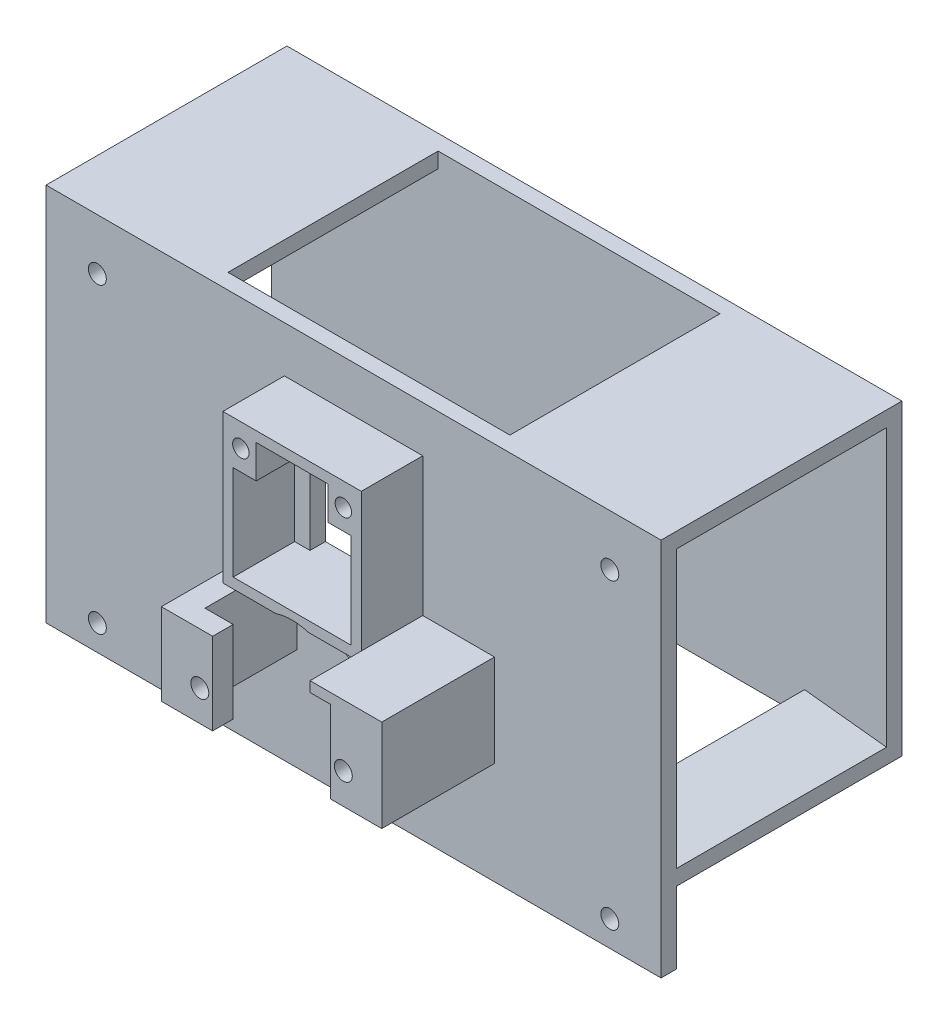
from build123d import *
from build123d.topology import SkipClean

# Parameters (mm, degrees)
SKETCH_1_W           = 120
SKETCH_1_H           = 60
EXTRUDE_1_DEPTH      = 47
SHELL_2_T            = -3
SKETCH_2_W           = 55
SKETCH_2_H           = 41
CUT_EXTRUDE_1_DEPTH  = 3
SKETCH_5_W           = 88
SKETCH_5_H           = 41
CUT_EXTRUDE_3_DEPTH  = 10
SKETCH_6_R           = 2.5
CUT_EXTRUDE_4_DEPTH  = 82.908485519
EXTRUDE_4_REACH      = 82.225
CUT_EXTRUDE_5_REACH  = 83.908
SKETCH_9_W           = 17
SKETCH_9_H           = 25
SKETCH_10_W          = 27
SKETCH_10_H          = 29
SKETCH_10_R          = 1.6
EXTRUDE_5_DEPTH      = 12
SKETCH_14_W          = 10
SKETCH_14_H          = 16
SKETCH_14_R          = 1.75
EXTRUDE_7_DEPTH      = 22
SKETCH_15_R          = 10.5
CUT_EXTRUDE_7_DEPTH  = 12
CUT_EXTRUDE_8_DEPTH  = 6
CUT_EXTRUDE_9_REACH  = 83.908
SKETCH_19_W          = 34
SKETCH_19_H          = 16
SKETCH_16_W          = 14
SKETCH_16_H          = 2
EXTRUDE_8_DEPTH      = 22
SKETCH_20_W          = 6
SKETCH_20_H          = 6
CUT_EXTRUDE_10_DEPTH = 5
SKETCH_21_W          = 120
SKETCH_21_H          = 3
EXTRUDE_9_DEPTH      = 14
SKETCH_11_R          = 1.75
CUT_EXTRUDE_6_DEPTH  = 89.005681635


with BuildPart() as part:
    # 草图1 → 凸台-拉伸1 (new body)
    with BuildSketch(Plane(origin=(0, 0, 0), x_dir=(1, 0, 0), z_dir=(0, 0, -1))):
        Rectangle(SKETCH_1_W, SKETCH_1_H)
    extrude(amount=EXTRUDE_1_DEPTH)

    # 抽壳2
    shell_2_openings = [part.faces().sort_by_distance(p)[0] for p in [
        (60, 0, -23.5),
        (-60, 0, -23.5),
    ]]
    offset(amount=SHELL_2_T, openings=shell_2_openings, kind=Kind.INTERSECTION)

    # 草图2 → 切除-拉伸1 (cut)
    with BuildSketch(Plane(origin=(0, 30, 45), x_dir=(-1, 0, 0), z_dir=(0, -1, 0))):
        with Locations((0, 68.5)):
            Rectangle(SKETCH_2_W, SKETCH_2_H)
    extrude(amount=CUT_EXTRUDE_1_DEPTH, mode=Mode.SUBTRACT)

    # 草图5 → 切除-拉伸3 (cut)
    with BuildSketch(Plane.XZ.offset(30)):
        with Locations((0, -23.5)):
            Rectangle(SKETCH_5_W, SKETCH_5_H)
    extrude(amount=-CUT_EXTRUDE_3_DEPTH, mode=Mode.SUBTRACT)

    # 草图6 → 切除-拉伸4 (cut, through all)
    with BuildSketch(Plane.XY):
        with Locations((0, -18)):
            Circle(SKETCH_6_R)
    extrude(amount=-CUT_EXTRUDE_4_DEPTH, mode=Mode.SUBTRACT)

    # 草图8 → 凸台-拉伸4 (add, up to next)
    with BuildSketch(Plane(origin=(0, 0, -44), x_dir=(-1, 0, 0), z_dir=(0, 0, -1)), mode=Mode.PRIVATE) as extrude_4_sk1:
        Polygon((-60, -27), (-44, -25.270549885), (-44, -30), (-60, -30), align=None)
    extrude_4_tool1 = extrude(extrude_4_sk1.sketch, amount=-EXTRUDE_4_REACH, mode=Mode.PRIVATE) - part.part
    extrude_4 = extrude_4_tool1.solids().sort_by_distance((51.403338, -28.035391, -44))[0]
    add(extrude_4)

    # 镜向1: 凸台-拉伸4 across plane
    add(extrude_4.mirror(Plane(origin=(0, 0, 0), x_dir=(0, 0, 1), z_dir=(1, 0, 0))))

    # 草图9 → 切除-拉伸5 (cut, up to next)
    with BuildSketch(Plane.XY, mode=Mode.PRIVATE) as cut_extrude_5_sk1:
        with Locations((0, 6.5)):
            Rectangle(SKETCH_9_W, SKETCH_9_H)
    cut_extrude_5_tool1 = extrude(cut_extrude_5_sk1.sketch, amount=-CUT_EXTRUDE_5_REACH, mode=Mode.PRIVATE) & part.part
    add(cut_extrude_5_tool1.solids().sort_by_distance((0, 6.5, 0))[0], mode=Mode.SUBTRACT)

    # 草图10 → 凸台-拉伸5 (add)
    with BuildSketch(Plane.XY):
        with Locations((0, 6.5)):
            Rectangle(SKETCH_10_W, SKETCH_10_H)
        with Locations(Location((-10, 16.5, 0), (0, 0, 339.635865194))):
            Circle(SKETCH_10_R, mode=Mode.SUBTRACT)
        with Locations(Location((10, 16.5, 0), (0, 0, 159.635865194))):
            Circle(SKETCH_10_R, mode=Mode.SUBTRACT)
        Polygon((-11.5, -6), (11.5, -6), (11.5, 12.5), (7, 12.5), (7, 19), (-7, 19), (-7, 12.5), (-11.5, 12.5), align=None, mode=Mode.SUBTRACT)
    extrude(amount=EXTRUDE_5_DEPTH)

    # 草图14 → 凸台-拉伸7 (add)
    # profile 1 of 2: a face of its own
    with BuildSketch(Plane.XY):
        with Locations((-10.5, -16)):
            Rectangle(SKETCH_14_W, SKETCH_14_H)
        with Locations((-8, -18)):
            Circle(SKETCH_14_R, mode=Mode.SUBTRACT)
    # profile 2 of 2: a face of its own
    with BuildSketch(Plane.XY):
        with Locations((22.5, -16)):
            Rectangle(SKETCH_14_W, SKETCH_14_H)
        with Locations((20, -18)):
            Circle(SKETCH_14_R, mode=Mode.SUBTRACT)
    extrude(amount=EXTRUDE_7_DEPTH)

    # 草图15 → 切除-拉伸7 (cut)
    with BuildSketch(Plane.XY):
        with Locations((0, -18)):
            Circle(SKETCH_15_R)
    extrude(amount=CUT_EXTRUDE_7_DEPTH, mode=Mode.SUBTRACT)

    # 草图17 → 切除-拉伸8 (cut)
    with SkipClean():  # the faces are left unmerged after this step: merging them gives an invalid solid
        with BuildSketch(Plane(origin=(0, 0, 12), x_dir=(-1, 0, 0), z_dir=(0, 0, -1))):
            with BuildLine():
                Line((5.5, -9.05572809), (5.5, -24))
                Line((5.5, -24), (8.61684397, -24))
                ThreePointArc((8.61684397, -24), (10.278819808, -15.856203519), (5.5, -9.05572809))
            make_face()
        extrude(amount=-CUT_EXTRUDE_8_DEPTH, mode=Mode.SUBTRACT)

    # 切除-拉伸9: up to this face of the body (flat: up to its plane)
    cut_extrude_9_end = Plane(part.part.faces().sort_by_distance((-5.657585298, -16.527864045, 18))[0])
    # 草图19 → 切除-拉伸9 (cut, up to the picked face)
    with BuildSketch(Plane.XY, mode=Mode.PRIVATE) as cut_extrude_9_sk1:
        with Locations((6, -16)):
            Rectangle(SKETCH_19_W, SKETCH_19_H)
    cut_extrude_9_tool1 = split(extrude(cut_extrude_9_sk1.sketch, amount=CUT_EXTRUDE_9_REACH, mode=Mode.PRIVATE), bisect_by=cut_extrude_9_end, keep=Keep.BOTH, mode=Mode.PRIVATE)
    add(cut_extrude_9_tool1.solids().sort_by(Axis((6, -16, 0), (0, 0, 1)))[0], mode=Mode.SUBTRACT)

    # 草图16 → 凸台-拉伸8 (add)
    with BuildSketch(Plane.XY):
        with Locations((20.5, -7)):
            Rectangle(SKETCH_16_W, SKETCH_16_H)
    extrude(amount=EXTRUDE_8_DEPTH)

    # 草图20 → 切除-拉伸10 (cut)
    with BuildSketch(Plane(origin=(0, 0, -3), x_dir=(-1, 0, 0), z_dir=(0, 0, -1))):
        with Locations((-10, 16.5)):
            Rectangle(SKETCH_20_W, SKETCH_20_H)
        with Locations((10, 16.5)):
            Rectangle(SKETCH_20_W, SKETCH_20_H)
    extrude(amount=-CUT_EXTRUDE_10_DEPTH, mode=Mode.SUBTRACT)

    # 草图21 → 凸台-拉伸9 (add)
    with BuildSketch(Plane.XZ.offset(30)):
        with Locations((0, -1.5)):
            Rectangle(SKETCH_21_W, SKETCH_21_H)
    extrude(amount=EXTRUDE_9_DEPTH)

    # 草图11 → 切除-拉伸6 (cut, through all)
    with BuildSketch(Plane(origin=(0, 0, 0), x_dir=(-1, 0, 0), z_dir=(0, 0, -1))):
        with Locations(Location((-50, 20, 0), (0, 0, 180))):
            Circle(SKETCH_11_R)
        with Locations(Location((50, 20, 0), (0, 0, 180))):
            Circle(SKETCH_11_R)
        with Locations(Location((-50, -39, 0), (0, 0, 180))):
            Circle(SKETCH_11_R)
        with Locations(Location((50, -39, 0), (0, 0, 180))):
            Circle(SKETCH_11_R)
    extrude(amount=CUT_EXTRUDE_6_DEPTH, mode=Mode.SUBTRACT)


solid = part.part
